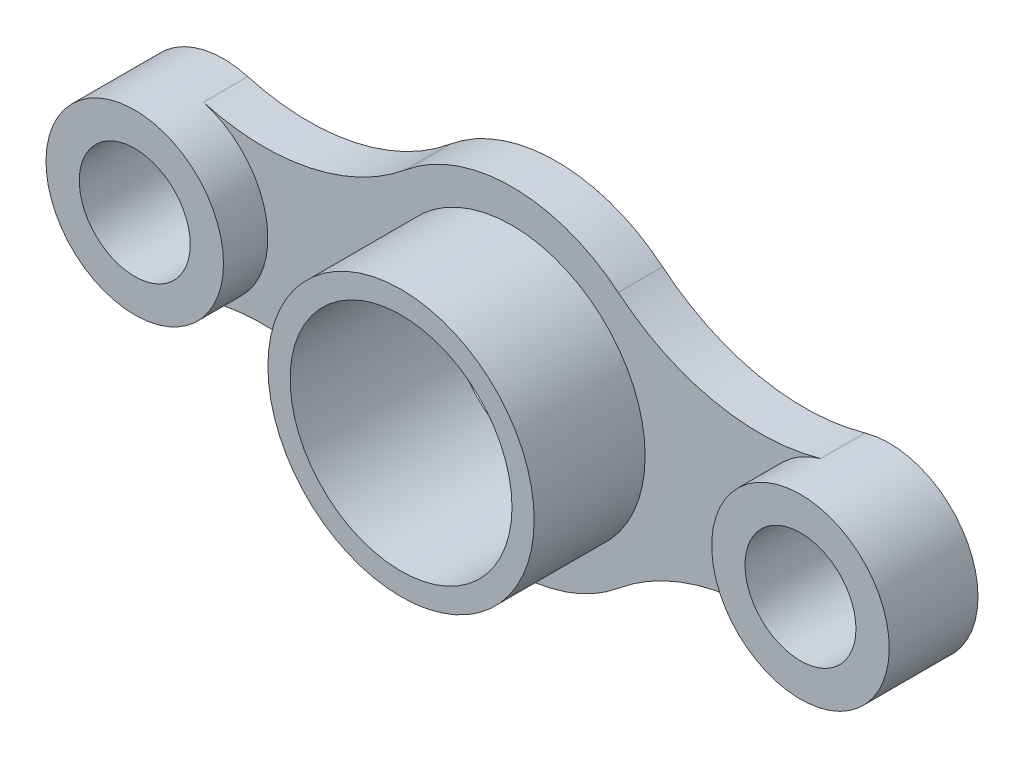
from build123d import *

# Parameters (mm, degrees)
BOSS_EXTRUDE1_DEPTH     = 20
SKETCH3_R               = 40
BOSS_EXTRUDE2_DEPTH     = 20
SKETCH4_R               = 60
BOSS_EXTRUDE3_DEPTH     = 50
CUT_EXTRUDE1_DEPTH      = 211.297408448
CUT_EXTRUDE1_DEPTH_BACK = 211.297408448
SKETCH5_R               = 50
SKETCH5_R_2             = 25


with BuildPart() as part:
    # Sketch1 → Boss-Extrude1 (new body)
    with BuildSketch(Plane.XY):
        with BuildLine():
            ThreePointArc((-47.892857143, -57.717191847), (0, -75), (47.892857143, -57.717191847))
            ThreePointArc((47.892857143, -57.717191847), (91.104177178, -36.827906099), (139.071428571, -38.478127898))
            ThreePointArc((139.071428571, -38.478127898), (190, 0), (139.071428571, 38.478127898))
            ThreePointArc((139.071428571, 38.478127898), (91.104177178, 36.827906099), (47.892857143, 57.717191847))
            ThreePointArc((47.892857143, 57.717191847), (0, 75), (-47.892857143, 57.717191847))
            ThreePointArc((-47.892857143, 57.717191847), (-91.104177178, 36.827906099), (-139.071428571, 38.478127898))
            ThreePointArc((-139.071428571, 38.478127898), (-190, 0), (-139.071428571, -38.478127898))
            ThreePointArc((-139.071428571, -38.478127898), (-91.104177178, -36.827906099), (-47.892857143, -57.717191847))
        make_face()
    extrude(amount=BOSS_EXTRUDE1_DEPTH)

    # Sketch3 → Boss-Extrude2 (add)
    with BuildSketch(Plane.XY.offset(20)):
        with Locations(Location((-150, 0, 0), (0, 0, 285.855625477))):
            Circle(SKETCH3_R)
        with Locations(Location((150, 0, 0), (0, 0, 105.855625477))):
            Circle(SKETCH3_R)
    extrude(amount=BOSS_EXTRUDE2_DEPTH)

    # Sketch4 → Boss-Extrude3 (add)
    with BuildSketch(Plane.XY.offset(20)):
        with Locations(Location((0, 0, 0), (0, 0, 180))):
            Circle(SKETCH4_R)
    extrude(amount=BOSS_EXTRUDE3_DEPTH)

    # Sketch5 → Cut-Extrude1 (cut, two sides: drawn at the far end of the back side and taken through both)
    with BuildSketch(Plane.XY.offset(20).offset(-CUT_EXTRUDE1_DEPTH_BACK)):
        Circle(SKETCH5_R)
        with Locations((-150, 0)):
            Circle(SKETCH5_R_2)
        with Locations((150, 0)):
            Circle(SKETCH5_R_2)
    extrude(amount=CUT_EXTRUDE1_DEPTH + CUT_EXTRUDE1_DEPTH_BACK, mode=Mode.SUBTRACT)


solid = part.part
